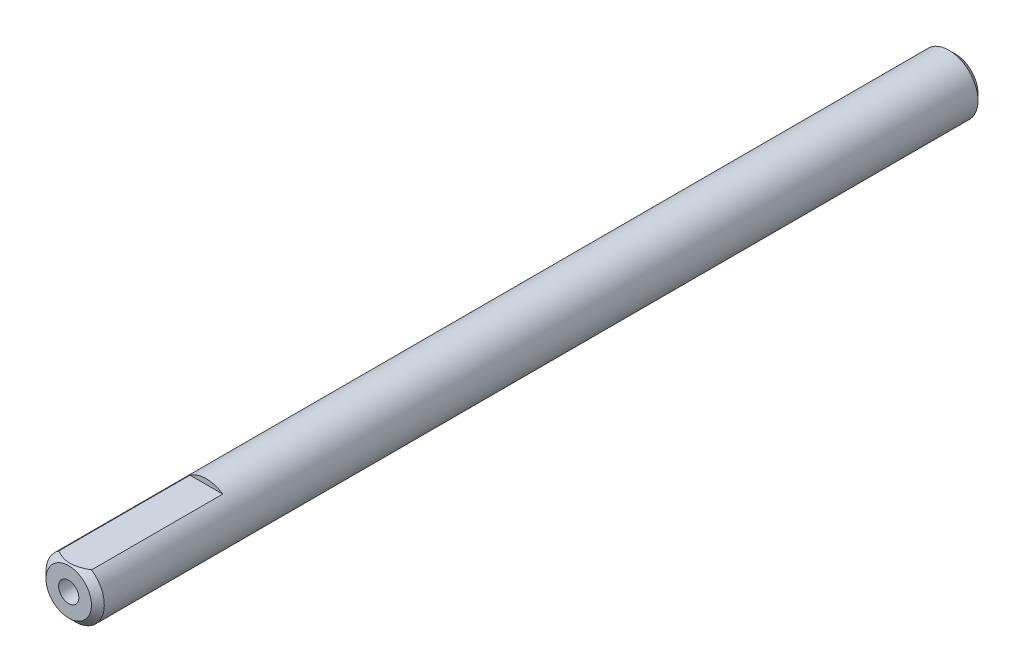
from build123d import *

# Parameters (mm, degrees)
IZIM1_R                     = 3.175
Y_KSEKLIK_EKSTR_ZYON1_DEPTH = 96.6
IZIM3_R                     = 1.1
KES_EKSTR_ZYON2_DEPTH       = 25
PAH1_SIZE                   = 0.7
PAH2_SIZE                   = 0.7
CORTE_EXTRUS_O1_START       = -15
CORTE_EXTRUS_O1_DEPTH       = 15


with BuildPart() as part:
    # Çizim1 → Yükseklik-Ekstrüzyon1 (new body)
    with BuildSketch(Plane.XY):
        with Locations(Location((0, 0, 0), (0, 0, 180))):
            Circle(IZIM1_R)
    extrude(amount=Y_KSEKLIK_EKSTR_ZYON1_DEPTH)

    # Çizim3 → Kes-Ekstrüzyon2 (cut)
    with BuildSketch(Plane.XY.offset(96.6)):
        Circle(IZIM3_R)
    extrude(amount=-KES_EKSTR_ZYON2_DEPTH, mode=Mode.SUBTRACT)

    # Pah1
    pah1_edges = [part.edges().sort_by_distance(p)[0] for p in [
        (3.175, 0, 96.6),
    ]]
    chamfer(pah1_edges, length=PAH1_SIZE)

    # Pah2
    pah2_edges = [part.edges().sort_by_distance(p)[0] for p in [
        (3.175, 0, 0),
    ]]
    chamfer(pah2_edges, length=PAH2_SIZE)

    # Esboço1 → Corte-extrusão1 (cut)
    with BuildSketch(Plane.XY.offset(96.6).offset(CORTE_EXTRUS_O1_START)):
        with BuildLine():
            Line((-1.78605711, 2.625), (1.78605711, 2.625))
            ThreePointArc((1.78605711, 2.625), (0, 3.175), (-1.78605711, 2.625))
        make_face()
    extrude(amount=CORTE_EXTRUS_O1_DEPTH, mode=Mode.SUBTRACT)


solid = part.part
